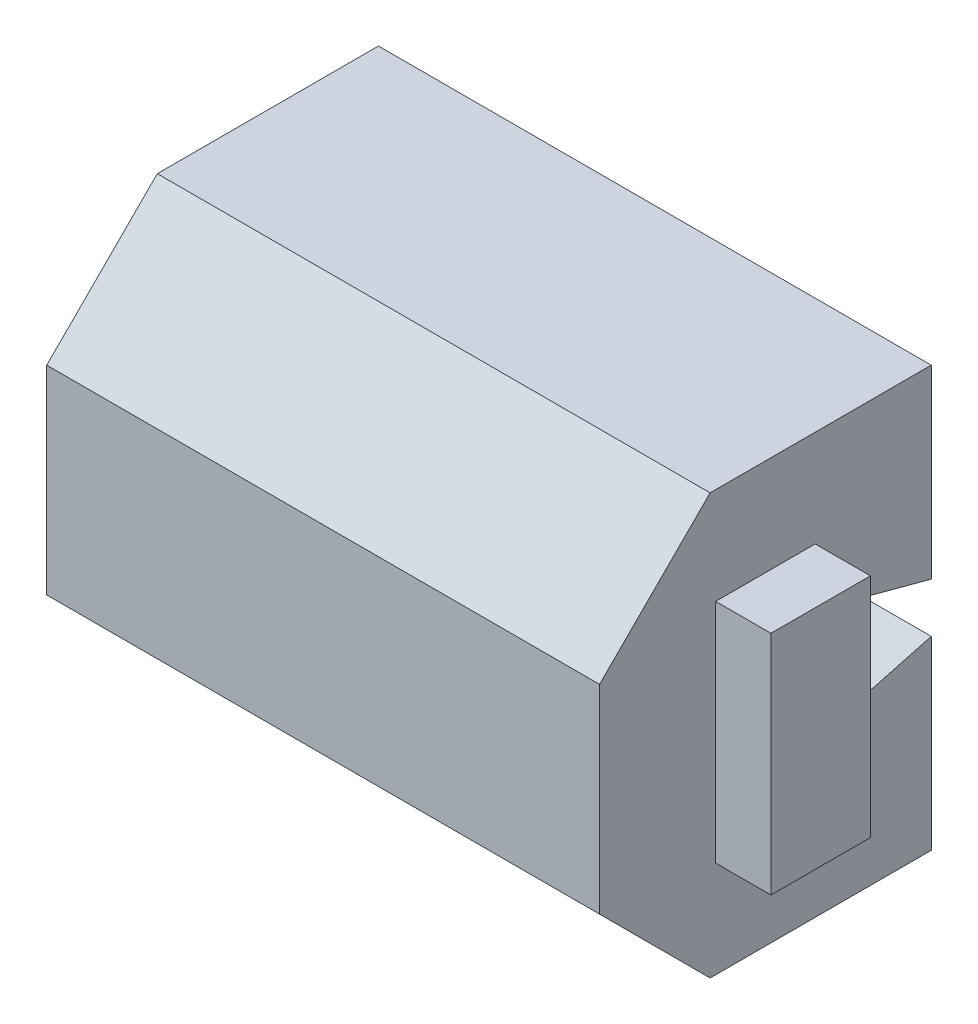
from build123d import *

# Parameters (mm, degrees)
SCHIZZO1_W                   = 20.5
SCHIZZO1_H                   = 9
ESTRUSIONE_ESTRUSIONE1_DEPTH = 5
SCHIZZO2_W                   = 38
SCHIZZO2_H                   = 30
ESTRUSIONE_ESTRUSIONE2_DEPTH = 50
TAGLIO_ESTRUSIONE1_DEPTH     = 61.09159675
M8_CLEARANCE_HOLE1_D         = 10
M8_CLEARANCE_HOLE1_DEPTH     = 40
M8_CLEARANCE_HOLE1_TIP       = 3.004303095
SMUSSO1_SIZE                 = 10


with BuildPart() as part:
    # Schizzo1 → Estrusione-Estrusione1 (new body)
    with BuildSketch(Plane.YZ):
        Rectangle(SCHIZZO1_W, SCHIZZO1_H)
    extrude(amount=ESTRUSIONE_ESTRUSIONE1_DEPTH)

    # Schizzo2 → Estrusione-Estrusione2 (add)
    with BuildSketch(Plane(origin=(0, 0, 0), x_dir=(0, -1, 0), z_dir=(-1, 0, 0))):
        Rectangle(SCHIZZO2_W, SCHIZZO2_H)
    extrude(amount=ESTRUSIONE_ESTRUSIONE2_DEPTH)

    # Schizzo3 → Taglio-Estrusione1 (cut, through all)
    with BuildSketch(Plane(origin=(-50, 0, 0), x_dir=(0, -1, 0), z_dir=(-1, 0, 0))):
        Polygon((2.240381057, -15), (4.25, -7.5), (-4.25, -7.5), (-2.240381057, -15), align=None)
    extrude(amount=-TAGLIO_ESTRUSIONE1_DEPTH, mode=Mode.SUBTRACT)

    # M8 Clearance Hole1
    with Locations(Plane.ZY.offset(50)):
        with Locations((0, 0)):
            Hole(M8_CLEARANCE_HOLE1_D / 2, depth=M8_CLEARANCE_HOLE1_DEPTH)
            with Locations((0, 0, -(M8_CLEARANCE_HOLE1_DEPTH + M8_CLEARANCE_HOLE1_TIP / 2))):  # 118° drill point
                Cone(0, M8_CLEARANCE_HOLE1_D / 2, M8_CLEARANCE_HOLE1_TIP, mode=Mode.SUBTRACT)

    # Smusso1
    smusso1_edges = [part.edges().sort_by_distance(p)[0] for p in [
        (-25, -19, 15),
        (-25, 19, 15),
    ]]
    chamfer(smusso1_edges, length=SMUSSO1_SIZE)


solid = part.part
